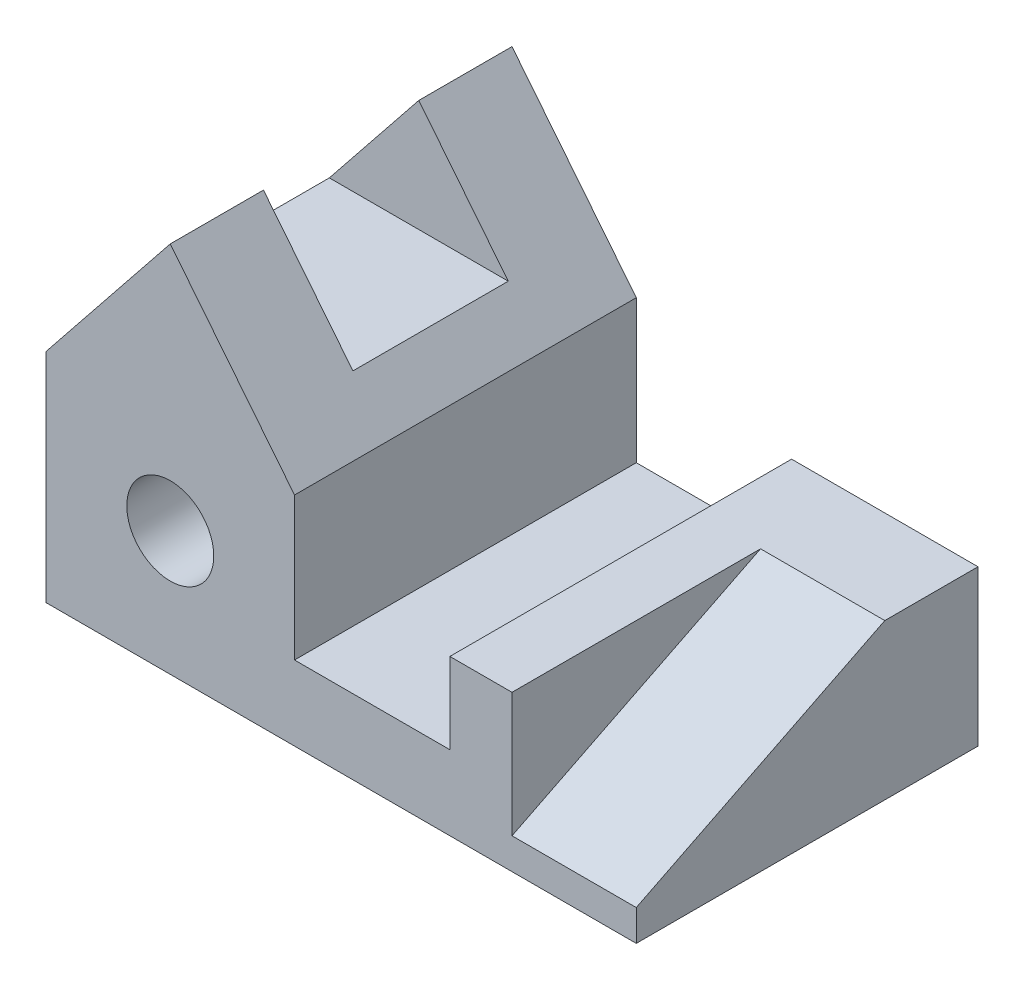
from build123d import *

# Parameters (mm, degrees)
ESBO_O1_R                = 7
RESSALTO_EXTRUS_O1_DEPTH = 55
CORTE_EXTRUS_O1_REACH    = 127.707
ESBO_O2_W                = 25
ESBO_O2_H                = 18
CORTE_EXTRUS_O2_DEPTH    = 20


with BuildPart() as part:
    # Esboço1 → Ressalto-extrusão1 (new body)
    with BuildSketch(Plane.XY):
        Polygon((-86.062995877, 1.256505599), (-86.062995877, 36.256505599), (-66.062995877, 61.256505599), (-46.062995877, 36.256505599), (-46.062995877, 13.256505599), (-21.062995877, 13.256505599), (-21.062995877, 26.256505599), (8.937004123, 26.256505599), (8.937004123, 1.256505599), align=None)
        with Locations((-66.062995877, 21.256505599)):
            Circle(ESBO_O1_R, mode=Mode.SUBTRACT)
    extrude(amount=-RESSALTO_EXTRUS_O1_DEPTH)

    # Corte-extrusão1: up to this plane
    corte_extrus_o1_end = Plane(origin=(-66.062995877, 61.256505599, -55), z_dir=(0.7808688094430304, 0.6246950475544243, 0))
    # Esboço2 → Corte-extrusão1 (cut, up to the surface)
    with BuildSketch(Plane.ZY.offset(86.062995877), mode=Mode.PRIVATE) as corte_extrus_o1_sk1:
        with Locations((-27.5, 52.256505599)):
            Rectangle(ESBO_O2_W, ESBO_O2_H)
    corte_extrus_o1_tool1 = split(extrude(corte_extrus_o1_sk1.sketch, amount=-CORTE_EXTRUS_O1_REACH, mode=Mode.PRIVATE), bisect_by=corte_extrus_o1_end, keep=Keep.BOTH, mode=Mode.PRIVATE)
    add(corte_extrus_o1_tool1.solids().sort_by_distance((-86.062996, 52.256506, -27.5))[0], mode=Mode.SUBTRACT)

    # Esboço3 → Corte-extrusão2 (cut)
    with BuildSketch(Plane(origin=(8.937004123, 0, 0), x_dir=(0, 0, -1), z_dir=(1, 0, 0))):
        Polygon((0, 6.256505599), (40, 26.256505599), (0, 26.256505599), align=None)
    extrude(amount=-CORTE_EXTRUS_O2_DEPTH, mode=Mode.SUBTRACT)


solid = part.part
